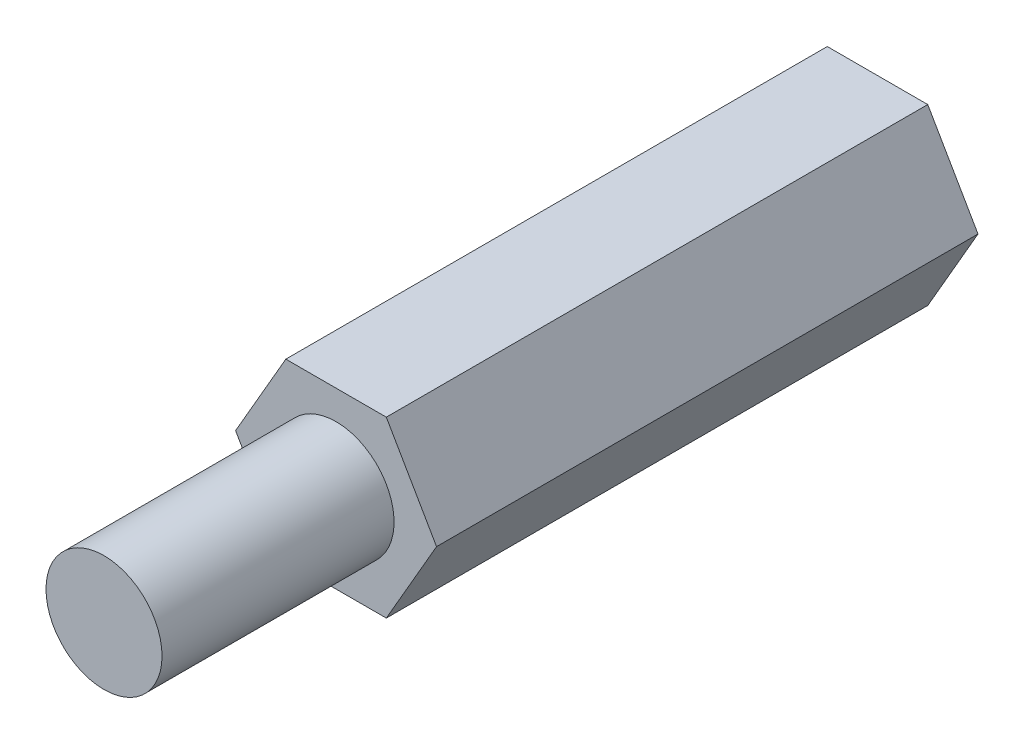
from build123d import *

# Parameters (mm, degrees)
SKETCH1_R           = 1.5
BOSS_EXTRUDE1_DEPTH = 6
BOSS_EXTRUDE2_DEPTH = 14
SKETCH3_R           = 1.5
CUT_EXTRUDE1_DEPTH  = 4.5


with BuildPart() as part:
    # Sketch1 → Boss-Extrude1 (new body)
    with BuildSketch(Plane.XY):
        Circle(SKETCH1_R)
    extrude(amount=BOSS_EXTRUDE1_DEPTH)

    # Sketch2 → Boss-Extrude2 (add)
    with BuildSketch(Plane(origin=(0, 0, 0), x_dir=(-1, 0, 0), z_dir=(0, 0, -1))):
        Polygon((1.299038106, 2.25), (-1.299038106, 2.25), (-2.598076211, 0), (-1.299038106, -2.25), (1.299038106, -2.25), (2.598076211, 0), align=None)
    extrude(amount=BOSS_EXTRUDE2_DEPTH)

    # Sketch3 → Cut-Extrude1 (cut)
    with BuildSketch(Plane(origin=(0, 0, -14), x_dir=(-1, 0, 0), z_dir=(0, 0, -1))):
        Circle(SKETCH3_R)
    extrude(amount=-CUT_EXTRUDE1_DEPTH, mode=Mode.SUBTRACT)


solid = part.part
